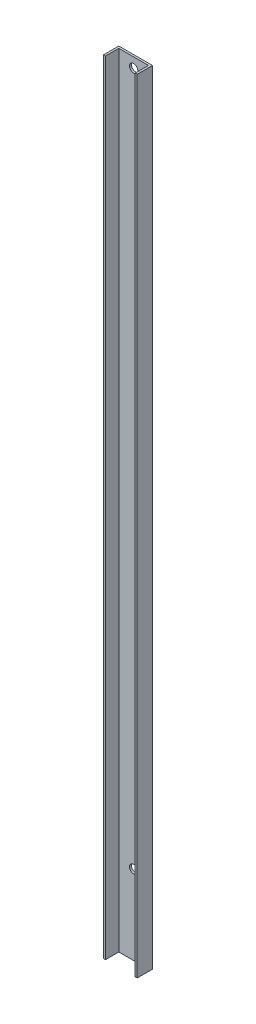
from build123d import *

# Parameters (mm, degrees)
EXTRUDE_THIN1_DEPTH = 430
SKETCH2_R           = 2.1
CUT_EXTRUDE1_DEPTH  = 10
SKETCH3_W           = 27.877816903
SKETCH3_H           = 42.526750181
CUT_EXTRUDE2_DEPTH  = 10


with BuildPart() as part:
    # Sketch1 → Extrude-Thin1 (new body)
    with BuildSketch(Plane(origin=(0, 0, 0), x_dir=(1, 0, 0), z_dir=(0, 1, 0))):
        Polygon((-10.945454545, 0), (-10.945454545, 7.7), (6.054545455, 7.7), (6.054545455, 0), (5.054545455, 0), (5.054545455, 6.7), (-9.945454545, 6.7), (-9.945454545, 0), align=None)
    extrude(amount=EXTRUDE_THIN1_DEPTH)

    # Sketch2 → Cut-Extrude1 (cut)
    with BuildSketch(Plane.XY.offset(-6.7)):
        with Locations((-2.445454545, 390)):
            Circle(SKETCH2_R)
        with Locations(Location((-2.445454545, 40, 0), (0, 0, 180))):
            Circle(SKETCH2_R)
    extrude(amount=-CUT_EXTRUDE1_DEPTH, mode=Mode.SUBTRACT)

    # Sketch3 → Cut-Extrude2 (cut)
    with BuildSketch(Plane.XY):
        with Locations((-4.854182527, 416.263375091)):
            Rectangle(SKETCH3_W, SKETCH3_H)
    extrude(amount=-CUT_EXTRUDE2_DEPTH, mode=Mode.SUBTRACT)


solid = part.part
